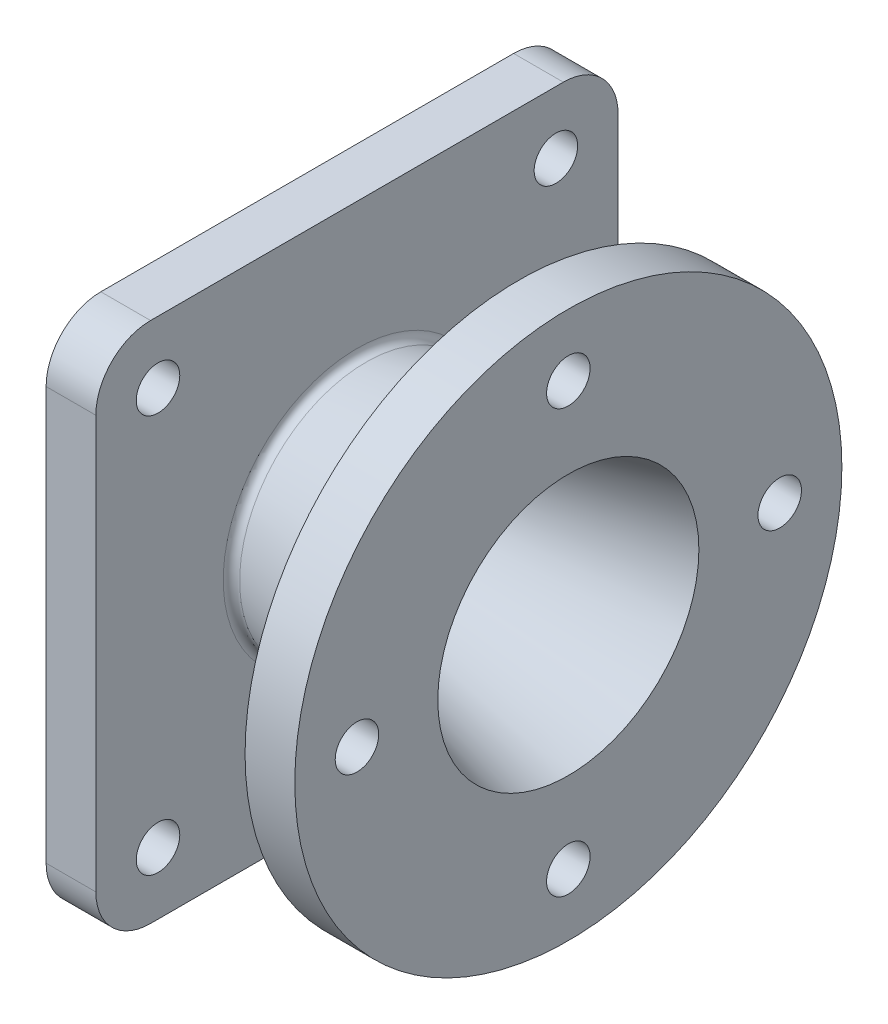
from build123d import *

# Parameters (mm, degrees)
CUT_EXTRUDE_1_REACH      = 204.731
SKETCH_2_R               = 8.75
PATTERN_CIRCULAR_1_COUNT = 4
EXTRUDE_START            = -20
SKETCH_3_W               = 210
SKETCH_3_H               = 210
SKETCH_3_R               = 35
EXTRUDE_1_DEPTH          = 20
SKETCH_4_R               = 8.75
CUT_EXTRUDE_2_DEPTH      = 20
FILLET_1_R               = 22
PATTERN_CIRCULAR_5_COUNT = 4
CHAMFER_1_SIZE           = 3.2875
FILLET_2_R               = 3


with BuildPart() as part:
    # Эскиз1 → Повернуть1 (revolve)
    with BuildSketch(Plane.XY, mode=Mode.PRIVATE) as revolve_1_sk:
        Polygon((0, 52.5), (0, 110), (-20, 110), (-20, 65), (-85, 50), (-85, 105), (-105, 105), (-105, 62.5), (-130, 62.5), (-130, 28.7125), (-113, 28.7125), (-113, 35), (-105, 35), (-105, 25), align=None)
    revolve(revolve_1_sk.sketch.rotate(Axis((0, 0, 0), (-1, 0, 0)), 90), axis=Axis((0, 0, 0), (-1, 0, 0)))

    # Эскиз2 → Вырез-Вытянуть1 (cut, up to next)
    with BuildSketch(Plane(origin=(0, 0, 0), x_dir=(0, 0, -1), z_dir=(1, 0, 0)), mode=Mode.PRIVATE) as cut_extrude_1_sk1:
        with Locations((0, 85)):
            Circle(SKETCH_2_R)
    cut_extrude_1_tool1 = extrude(cut_extrude_1_sk1.sketch, amount=-CUT_EXTRUDE_1_REACH, mode=Mode.PRIVATE) & part.part
    cut_extrude_1 = cut_extrude_1_tool1.solids().sort_by_distance((0, 85, 0))[0]
    add(cut_extrude_1, mode=Mode.SUBTRACT)

    # Круговой массив1: Вырез-Вытянуть1 ×4 about axis
    pattern_circular_1_axis = Axis((0, 0, 0), (1, 0, 0))
    for i in range(1, PATTERN_CIRCULAR_1_COUNT):
        add(cut_extrude_1.rotate(pattern_circular_1_axis, i * 360 / PATTERN_CIRCULAR_1_COUNT), mode=Mode.SUBTRACT)

    # Эскиз3 → Бобышка-Вытянуть1 (add)
    with BuildSketch(Plane.ZY.offset(105).offset(EXTRUDE_START)):
        Rectangle(SKETCH_3_W, SKETCH_3_H)
        with Locations(Location((0, 0, 0), (0, 0, 180))):
            Circle(SKETCH_3_R, mode=Mode.SUBTRACT)
    extrude(amount=EXTRUDE_1_DEPTH)

    # Эскиз4 → Вырез-Вытянуть2 (cut)
    with BuildSketch(Plane.ZY.offset(105)):
        with Locations((80, 80)):
            Circle(SKETCH_4_R)
    cut_extrude_2 = extrude(amount=-CUT_EXTRUDE_2_DEPTH, mode=Mode.SUBTRACT)

    # Скругление1
    fillet_1_edges = [part.edges().sort_by_distance(p)[0] for p in [
        (-95, 105, 105),
        (-95, -105, 105),
        (-95, -105, -105),
        (-95, 105, -105),
    ]]
    fillet(fillet_1_edges, radius=FILLET_1_R)

    # Круговой массив5: Вырез-Вытянуть2 ×4 about axis
    pattern_circular_5_axis = Axis((0, 0, 0), (1, 0, 0))
    for i in range(1, PATTERN_CIRCULAR_5_COUNT):
        add(cut_extrude_2.rotate(pattern_circular_5_axis, i * 360 / PATTERN_CIRCULAR_5_COUNT), mode=Mode.SUBTRACT)

    # Фаска1
    chamfer_1_edges = [part.edges().sort_by_distance(p)[0] for p in [
        (-130, 0, 28.7125),
    ]]
    chamfer(chamfer_1_edges, length=CHAMFER_1_SIZE)

    # Скругление2
    fillet_2_edges = [part.edges().sort_by_distance(p)[0] for p in [
        (-20, 0, 65),
        (-85, 0, 50),
    ]]
    fillet(fillet_2_edges, radius=FILLET_2_R)


solid = part.part
